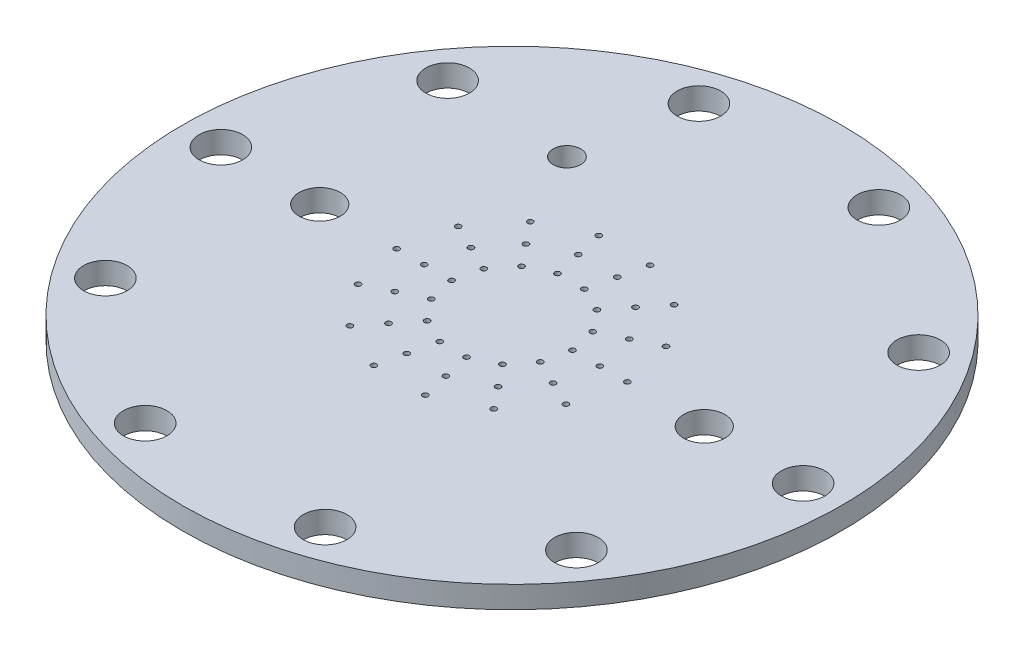
from build123d import *

# Parameters (mm, degrees)
F_3_8_CLEARANCE_HOLE1_D      = 10.0838
CIRPATTERN1_COUNT            = 10
F_3_8_0_375_DIAMETER_HOLE1_D = 9.525
F_1_4_0_25_DIAMETER_HOLE1_D  = 6.35
SKETCH7_R                    = 0.635
CUT_EXTRUDE1_DEPTH           = 2.54


with BuildPart() as part:
    # Sketch1 → Revolve1 (revolve)
    with BuildSketch(Plane.XY):
        Polygon((0, 0), (0, -5.08), (54.8259, -5.08), (54.8259, -2.3876), (58.8899, -2.3876), (58.8899, -5.08), (76.2, -5.08), (76.2, 0), align=None)
    revolve(axis=Axis((0, 0, 0), (0, -1, 0)))

    # 3/8 Clearance Hole1 (through all)
    with Locations(Plane(origin=(67.31, 0, 0), x_dir=(0, 0, 1), z_dir=(0, 1, 0))):
        with Locations((0, 0)):
            f_3_8_clearance_hole1 = Hole(F_3_8_CLEARANCE_HOLE1_D / 2)

    # CirPattern1: 3/8 Clearance Hole1 ×10 about axis
    cirpattern1_axis = Axis((0, -5.334, 0), (0, 1, 0))
    for i in range(1, CIRPATTERN1_COUNT):
        add(f_3_8_clearance_hole1.rotate(cirpattern1_axis, i * 360 / CIRPATTERN1_COUNT), mode=Mode.SUBTRACT)

    # 3/8 (0.375) Diameter Hole1 (through all)
    with Locations(Plane(origin=(44.45, 0, 0), x_dir=(0, 0, 1), z_dir=(0, 1, 0))):
        with Locations((0, 0), (0, -88.9)):
            Hole(F_3_8_0_375_DIAMETER_HOLE1_D / 2)

    # 1/4 (0.25) Diameter Hole1 (through all)
    with Locations(Plane(origin=(-25.4, 0, -38.1), x_dir=(0, 0, 1), z_dir=(0, 1, 0))):
        with Locations((0, 0)):
            Hole(F_1_4_0_25_DIAMETER_HOLE1_D / 2)

    # Sketch7 → Cut-Extrude1 (cut)
    with BuildSketch(Plane(origin=(0, 0, 0), x_dir=(1, 0, 0), z_dir=(0, 1, 0))):
        with Locations((13.97, 0)):
            Circle(SKETCH7_R)
        with Locations((20.32, 0)):
            Circle(SKETCH7_R)
        with Locations((26.67, 0)):
            Circle(SKETCH7_R)
        with Locations((12.586535085, -6.061355835)):
            Circle(SKETCH7_R)
        with Locations((18.307687396, -8.816517579)):
            Circle(SKETCH7_R)
        with Locations((24.028839707, -11.571679322)):
            Circle(SKETCH7_R)
        with Locations((8.710152532, -10.92218581)):
            Circle(SKETCH7_R)
        with Locations((12.669312774, -15.886815724)):
            Circle(SKETCH7_R)
        with Locations((16.628473016, -20.851445637)):
            Circle(SKETCH7_R)
        with Locations((3.108617447, -13.619742933)):
            Circle(SKETCH7_R)
        with Locations((4.521625378, -19.810535176)):
            Circle(SKETCH7_R)
        with Locations((5.934633309, -26.001327418)):
            Circle(SKETCH7_R)
        with Locations((-3.108617447, -13.619742933)):
            Circle(SKETCH7_R)
        with Locations((-4.521625378, -19.810535176)):
            Circle(SKETCH7_R)
        with Locations((-5.934633309, -26.001327418)):
            Circle(SKETCH7_R)
        with Locations((-8.710152532, -10.92218581)):
            Circle(SKETCH7_R)
        with Locations((-12.669312774, -15.886815724)):
            Circle(SKETCH7_R)
        with Locations((-16.628473016, -20.851445637)):
            Circle(SKETCH7_R)
        with Locations((-12.586535085, -6.061355835)):
            Circle(SKETCH7_R)
        with Locations((-18.307687396, -8.816517579)):
            Circle(SKETCH7_R)
        with Locations((-24.028839707, -11.571679322)):
            Circle(SKETCH7_R)
        with Locations((-13.97, 0)):
            Circle(SKETCH7_R)
        with Locations((-20.32, 0)):
            Circle(SKETCH7_R)
        with Locations((-26.67, 0)):
            Circle(SKETCH7_R)
        with Locations((-12.586535085, 6.061355835)):
            Circle(SKETCH7_R)
        with Locations((-18.307687396, 8.816517579)):
            Circle(SKETCH7_R)
        with Locations((-24.028839707, 11.571679322)):
            Circle(SKETCH7_R)
        with Locations((-8.710152532, 10.92218581)):
            Circle(SKETCH7_R)
        with Locations((-12.669312774, 15.886815724)):
            Circle(SKETCH7_R)
        with Locations((-16.628473016, 20.851445637)):
            Circle(SKETCH7_R)
        with Locations((-3.108617447, 13.619742933)):
            Circle(SKETCH7_R)
        with Locations((-4.521625378, 19.810535176)):
            Circle(SKETCH7_R)
        with Locations((-5.934633309, 26.001327418)):
            Circle(SKETCH7_R)
        with Locations((3.108617447, 13.619742933)):
            Circle(SKETCH7_R)
        with Locations((4.521625378, 19.810535176)):
            Circle(SKETCH7_R)
        with Locations((5.934633309, 26.001327418)):
            Circle(SKETCH7_R)
        with Locations((8.710152532, 10.92218581)):
            Circle(SKETCH7_R)
        with Locations((12.669312774, 15.886815724)):
            Circle(SKETCH7_R)
        with Locations((16.628473016, 20.851445637)):
            Circle(SKETCH7_R)
        with Locations((12.586535085, 6.061355835)):
            Circle(SKETCH7_R)
        with Locations((18.307687396, 8.816517579)):
            Circle(SKETCH7_R)
        with Locations((24.028839707, 11.571679322)):
            Circle(SKETCH7_R)
    extrude(amount=-CUT_EXTRUDE1_DEPTH, mode=Mode.SUBTRACT)


solid = part.part
